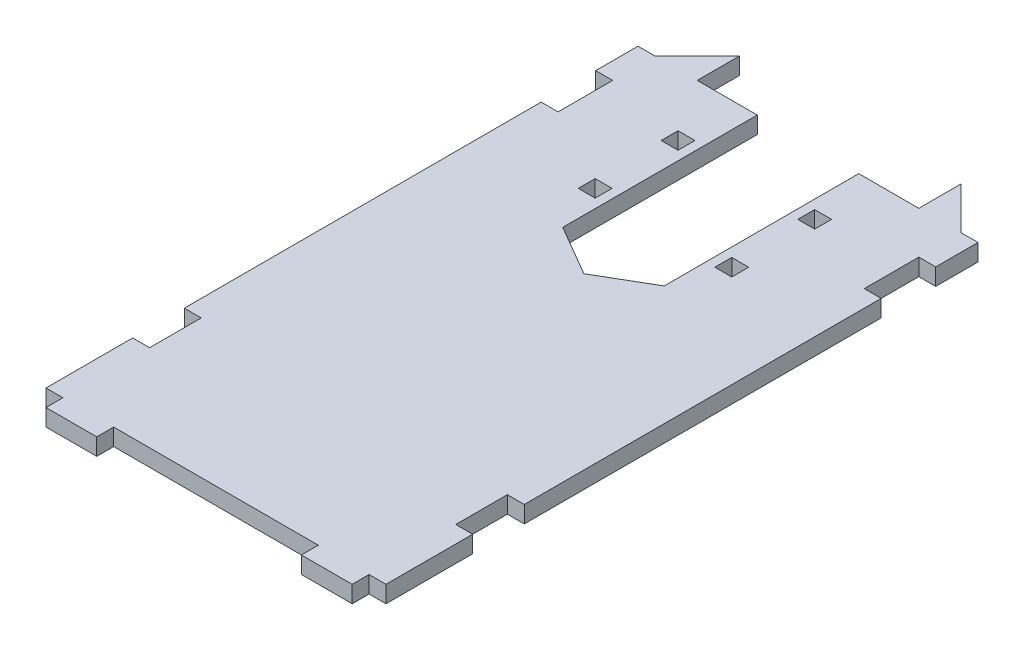
from build123d import *

# Parameters (mm, degrees)
SKETCH_1_W          = 40.2
SKETCH_1_H          = 70
EXTRUDE_1_DEPTH     = 2
SKETCH_2_W          = 2
SKETCH_2_H          = 6.1
SKETCH_2_H_2        = 6.45
CUT_EXTRUDE_1_DEPTH = 81.746764641
SKETCH_3_W          = 6
SKETCH_3_H          = 2
EXTRUDE_2_DEPTH     = 2
SKETCH_4_W          = 5
SKETCH_4_H          = 2
EXTRUDE_3_DEPTH     = 5
CUT_EXTRUDE_2_DEPTH = 86.117800723
CUT_EXTRUDE_3_DEPTH = 5
SKETCH_8_W          = 2
SKETCH_8_H          = 2
CUT_EXTRUDE_4_DEPTH = 5


with BuildPart() as part:
    # ｽｹｯﾁ1 → ﾎﾞｽ - 押し出し1 (new body)
    with BuildSketch(Plane(origin=(0, 0, 0), x_dir=(1, 0, 0), z_dir=(0, 1, 0))):
        with Locations((20.1, 35)):
            Rectangle(SKETCH_1_W, SKETCH_1_H)
    extrude(amount=EXTRUDE_1_DEPTH)

    # ｽｹｯﾁ2 → ｶｯﾄ - 押し出し1 (cut, through all)
    with BuildSketch(Plane(origin=(0, 2, 0), x_dir=(1, 0, 0), z_dir=(0, 1, 0))):
        with Locations((1, 13.3)):
            Rectangle(SKETCH_2_W, SKETCH_2_H)
        with Locations((39.2, 13.3)):
            Rectangle(SKETCH_2_W, SKETCH_2_H)
        with Locations((1, 61.775)):
            Rectangle(SKETCH_2_W, SKETCH_2_H_2)
        with Locations((39.2, 61.775)):
            Rectangle(SKETCH_2_W, SKETCH_2_H_2)
    extrude(amount=-CUT_EXTRUDE_1_DEPTH, mode=Mode.SUBTRACT)

    # ｽｹｯﾁ3 → ﾎﾞｽ - 押し出し2 (add)
    with BuildSketch(Plane.XY):
        with Locations((5, 1)):
            Rectangle(SKETCH_3_W, SKETCH_3_H)
        with Locations((35.2, 1)):
            Rectangle(SKETCH_3_W, SKETCH_3_H)
    extrude(amount=EXTRUDE_2_DEPTH)

    # ｽｹｯﾁ4 → ﾎﾞｽ - 押し出し3 (add)
    with BuildSketch(Plane(origin=(0, 0, -70), x_dir=(-1, 0, 0), z_dir=(0, 0, -1))):
        with Locations((-35.7, 1)):
            Rectangle(SKETCH_4_W, SKETCH_4_H)
        with Locations((-4.5, 1)):
            Rectangle(SKETCH_4_W, SKETCH_4_H)
    extrude(amount=EXTRUDE_3_DEPTH)

    # ｽｹｯﾁ5 → ｶｯﾄ - 押し出し2 (cut, through all)
    with BuildSketch(Plane(origin=(0, 2, 0), x_dir=(1, 0, 0), z_dir=(0, 1, 0))):
        Polygon((7, 75), (2, 70), (2, 75), align=None)
        Polygon((33.2, 75), (38.2, 70), (38.2, 75), align=None)
    extrude(amount=-CUT_EXTRUDE_2_DEPTH, mode=Mode.SUBTRACT)

    # ｽｹｯﾁ7 → ｶｯﾄ - 押し出し3 (cut)
    with BuildSketch(Plane(origin=(0, 2, 0), x_dir=(1, 0, 0), z_dir=(0, 1, 0))):
        Polygon((14.1, 70), (14.1, 47), (20.1, 43.5), (26.1, 47), (26.1, 70), align=None)
    extrude(amount=-CUT_EXTRUDE_3_DEPTH, mode=Mode.SUBTRACT)

    # ｽｹｯﾁ8 → ｶｯﾄ - 押し出し4 (cut)
    with BuildSketch(Plane(origin=(0, 2, 0), x_dir=(1, 0, 0), z_dir=(0, 1, 0))):
        with Locations((12.025, 62.71)):
            Rectangle(SKETCH_8_W, SKETCH_8_H)
        with Locations((12.025, 52.91)):
            Rectangle(SKETCH_8_W, SKETCH_8_H)
        with Locations((28.175, 62.71)):
            Rectangle(SKETCH_8_W, SKETCH_8_H)
        with Locations((28.175, 52.91)):
            Rectangle(SKETCH_8_W, SKETCH_8_H)
    extrude(amount=-CUT_EXTRUDE_4_DEPTH, mode=Mode.SUBTRACT)


solid = part.part
